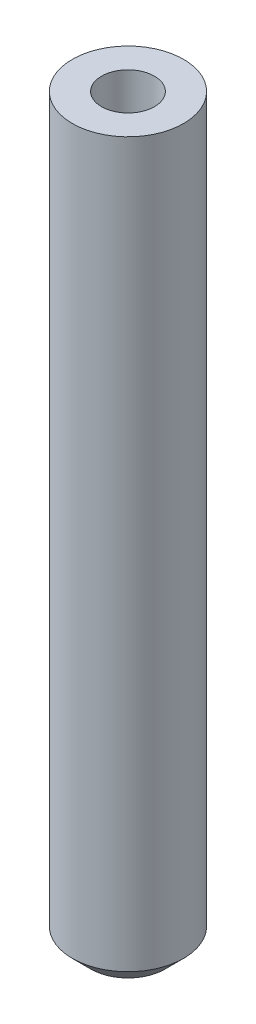
from build123d import *

# Parameters (mm, degrees)
SKETCH_1_R          = 3
EXTRUDE_1_DEPTH     = 40
SKETCH_2_R          = 1.427663882
CUT_EXTRUDE_1_DEPTH = 41.224370722
CHAMFER_1_SIZE      = 1


with BuildPart() as part:
    # 草图1 → 凸台-拉伸1 (new body)
    with BuildSketch(Plane(origin=(0, 0, 0), x_dir=(1, 0, 0), z_dir=(0, 1, 0))):
        with Locations(Location((0, 0, 0), (0, 0, 270))):
            Circle(SKETCH_1_R)
    extrude(amount=EXTRUDE_1_DEPTH)

    # 草图2 → 切除-拉伸1 (cut, through all)
    with BuildSketch(Plane.XZ):
        with Locations(Location((0, 0, 0), (0, 0, 270))):
            Circle(SKETCH_2_R)
    extrude(amount=-CUT_EXTRUDE_1_DEPTH, mode=Mode.SUBTRACT)

    # 倒角1
    chamfer_1_edges = [part.edges().sort_by_distance(p)[0] for p in [
        (0, 0, -3),
    ]]
    chamfer(chamfer_1_edges, length=CHAMFER_1_SIZE)


solid = part.part
